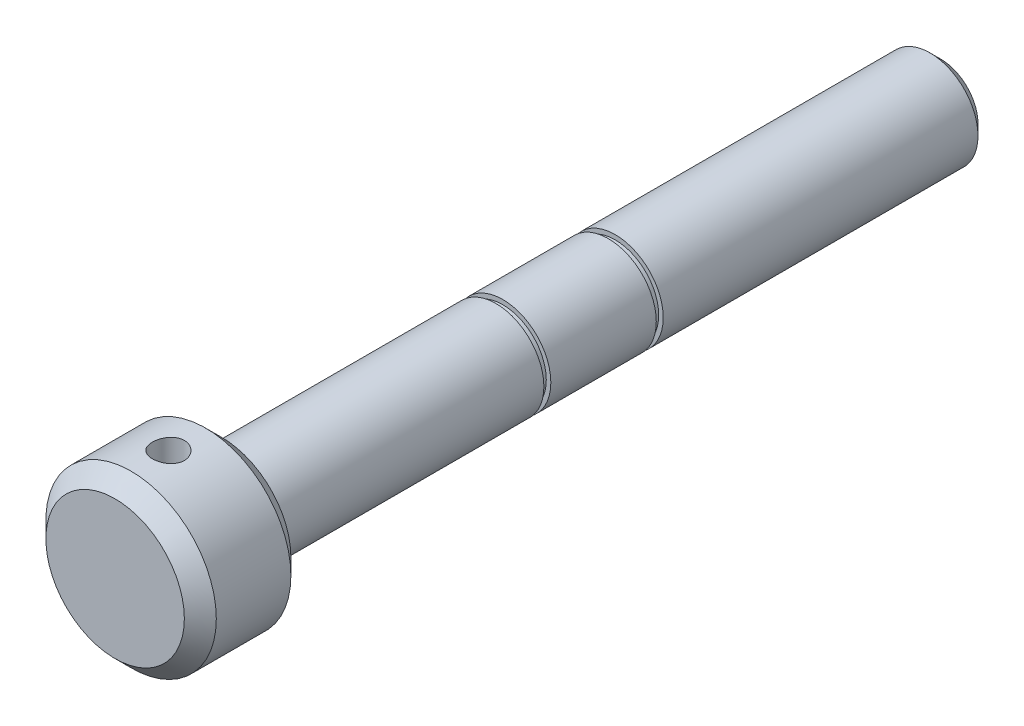
from build123d import *

# Parameters (mm, degrees)
SCHIZZO2_R                   = 9
ESTRUSIONE_ESTRUSIONE1_DEPTH = 135
SCHIZZO3_R                   = 16
ESTRUSIONE_ESTRUSIONE2_DEPTH = 20
TAGLIO_ESTRUSIONE1_REACH     = 161.075
SCHIZZO4_R                   = 3
SMUSSO1_SIZE                 = 3
SMUSSO2_SIZE                 = 2
TAGLIO_ESTRUSIONE2_START     = -1.3
SCHIZZO6_R                   = 9
SCHIZZO6_R_2                 = 8.15
TAGLIO_ESTRUSIONE2_DEPTH     = 1.3


with BuildPart() as part:
    # Schizzo2 → Estrusione-Estrusione1 (new body)
    with BuildSketch(Plane.XY):
        Circle(SCHIZZO2_R)
    extrude(amount=ESTRUSIONE_ESTRUSIONE1_DEPTH)

    # Schizzo3 → Estrusione-Estrusione2 (add)
    with BuildSketch(Plane.XY.offset(135)):
        Circle(SCHIZZO3_R)
    extrude(amount=ESTRUSIONE_ESTRUSIONE2_DEPTH)

    # Schizzo4 → Taglio-Estrusione1 (cut, up to next)
    with BuildSketch(Plane(origin=(0, 16, 0), x_dir=(1, 0, 0), z_dir=(0, 1, 0)), mode=Mode.PRIVATE) as taglio_estrusione1_sk1:
        with Locations(Location((0, -145, 0), (0, 0, 270))):
            Circle(SCHIZZO4_R)
    taglio_estrusione1_tool1 = extrude(taglio_estrusione1_sk1.sketch, amount=-TAGLIO_ESTRUSIONE1_REACH, mode=Mode.PRIVATE) & part.part
    add(taglio_estrusione1_tool1.solids().sort_by_distance((0, 16, 145))[0], mode=Mode.SUBTRACT)

    # Smusso1
    smusso1_edges = [part.edges().sort_by_distance(p)[0] for p in [
        (-16, 0, 135),
        (-16, 0, 155),
    ]]
    chamfer(smusso1_edges, length=SMUSSO1_SIZE)

    # Smusso2
    smusso2_edges = [part.edges().sort_by_distance(p)[0] for p in [
        (-9, 0, 0),
    ]]
    chamfer(smusso2_edges, length=SMUSSO2_SIZE)

    # Schizzo6 → Taglio-Estrusione2 (cut)
    with BuildSketch(Plane.XY.offset(83.5).offset(TAGLIO_ESTRUSIONE2_START)):
        Circle(SCHIZZO6_R)
        Circle(SCHIZZO6_R_2, mode=Mode.SUBTRACT)
    taglio_estrusione2 = extrude(amount=TAGLIO_ESTRUSIONE2_DEPTH, mode=Mode.SUBTRACT)

    # Specchia1: Taglio-Estrusione2 across plane
    add(taglio_estrusione2.mirror(Plane(origin=(0, 0, 72.3), x_dir=(1, 0, 0), z_dir=(0, 0, -1))), mode=Mode.SUBTRACT)


solid = part.part
